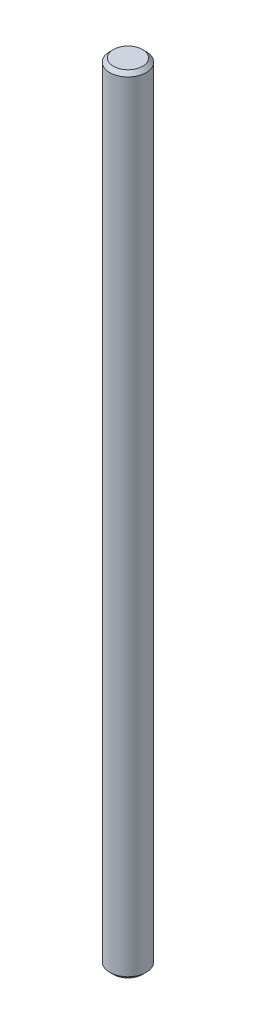
from build123d import *

# Parameters (mm, degrees)
SKETCH_1_R      = 2.5
EXTRUDE_1_DEPTH = 108
CHAMFER_1_SIZE  = 0.5


with BuildPart() as part:
    # 草图1 → 凸台-拉伸1 (new body)
    with BuildSketch(Plane(origin=(0, 0, 0), x_dir=(1, 0, 0), z_dir=(0, 1, 0))):
        with Locations(Location((0, 0, 0), (0, 0, 270))):
            Circle(SKETCH_1_R)
    extrude(amount=EXTRUDE_1_DEPTH)

    # 倒角1
    chamfer_1_edges = [part.edges().sort_by_distance(p)[0] for p in [
        (0, 0, -2.5),
        (0, 108, -2.5),
    ]]
    chamfer(chamfer_1_edges, length=CHAMFER_1_SIZE)


solid = part.part
